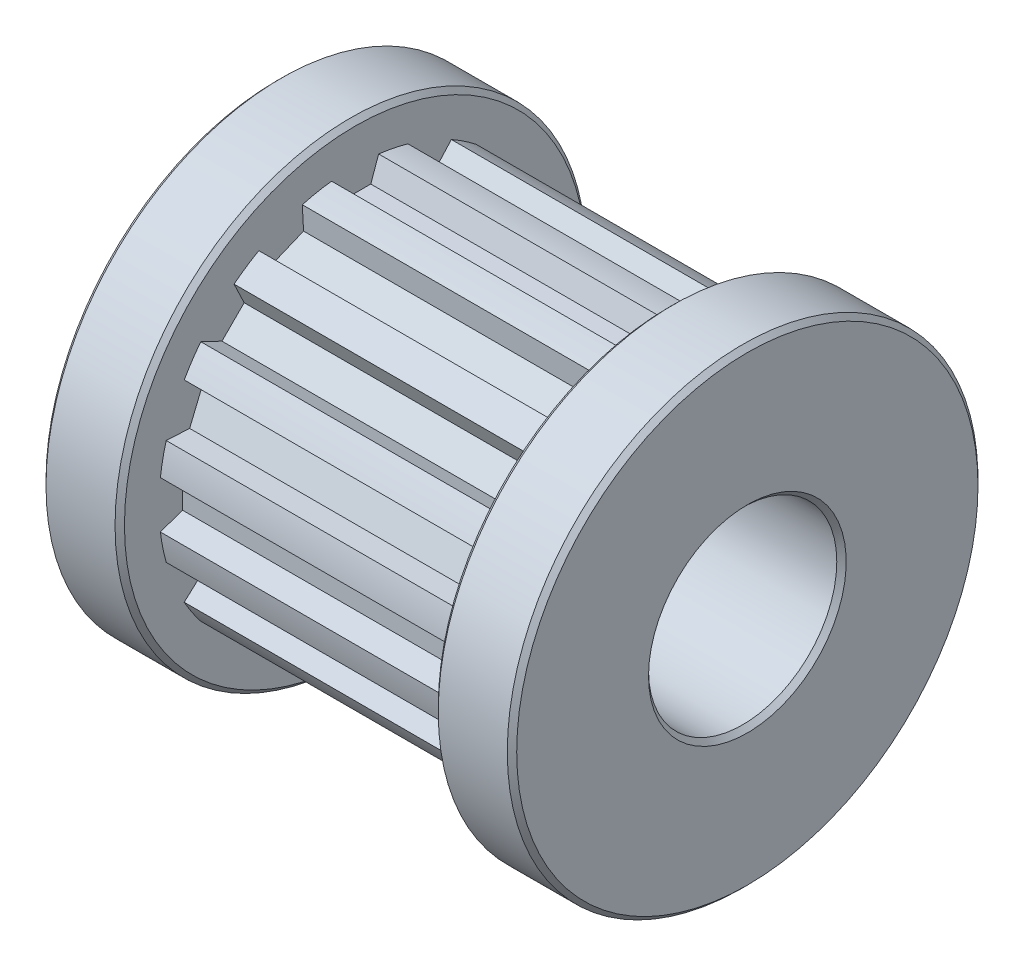
from build123d import *

# Parameters (mm, degrees)
SKETCH_2_R               = 2.75
CUT_EXTRUDE_1_DEPTH      = 37.742346142
CUT_EXTRUDE_START        = 20
CUT_EXTRUDE_2_DEPTH      = 20
PATTERN_CIRCULAR_1_COUNT = 16
CHAMFER_1_SIZE           = 0.3


with BuildPart() as part:
    # Эскиз1 → Повернуть1 (revolve)
    with BuildSketch(Plane.XY, mode=Mode.PRIVATE) as revolve_1_sk:
        Polygon((0, 6), (0, 15), (-5, 15), (-5, 12.5), (-25, 12.5), (-25, 15), (-30, 15), (-30, 6), align=None)
    revolve(revolve_1_sk.sketch.rotate(Axis((-33.310992453, 0, 0), (1, 0, 0)), 90), axis=Axis((-33.310992453, 0, 0), (1, 0, 0)))

    # Эскиз2 → Вырез-Вытянуть1 (cut, through all)
    with BuildSketch(Plane(origin=(0, 0, 0), x_dir=(1, 0, 0), z_dir=(0, 1, 0))):
        with Locations(Location((-12, 0, 0), (0, 0, 270))):
            Circle(SKETCH_2_R)
    extrude(amount=-CUT_EXTRUDE_1_DEPTH, mode=Mode.SUBTRACT)

    # Эскиз3 → Вырез-Вытянуть2 (cut)
    with BuildSketch(Plane.ZY.offset(5).offset(CUT_EXTRUDE_START)):
        with BuildLine():
            Line((-1.5, 12.409673646), (-1, 11))
            Line((-1, 11), (1, 11))
            Line((1, 11), (1.5, 12.409673646))
            ThreePointArc((1.5, 12.409673646), (0, 12.5), (-1.5, 12.409673646))
        make_face()
    cut_extrude_2 = extrude(amount=-CUT_EXTRUDE_2_DEPTH, mode=Mode.SUBTRACT)

    # Круговой массив1: Вырез-Вытянуть2 ×16 about axis
    pattern_circular_1_axis = Axis((0, 0, 0), (1, 0, 0))
    for i in range(1, PATTERN_CIRCULAR_1_COUNT):
        add(cut_extrude_2.rotate(pattern_circular_1_axis, i * 360 / PATTERN_CIRCULAR_1_COUNT), mode=Mode.SUBTRACT)

    # Фаска1
    chamfer_1_edges = [part.edges().sort_by_distance(p)[0] for p in [
        (0, 0, -6),
        (-30, 0, -6),
        (-30, 0, -15),
        (-25, 0, -15),
        (-5, 0, -15),
        (0, 0, -15),
    ]]
    chamfer(chamfer_1_edges, length=CHAMFER_1_SIZE)


solid = part.part
